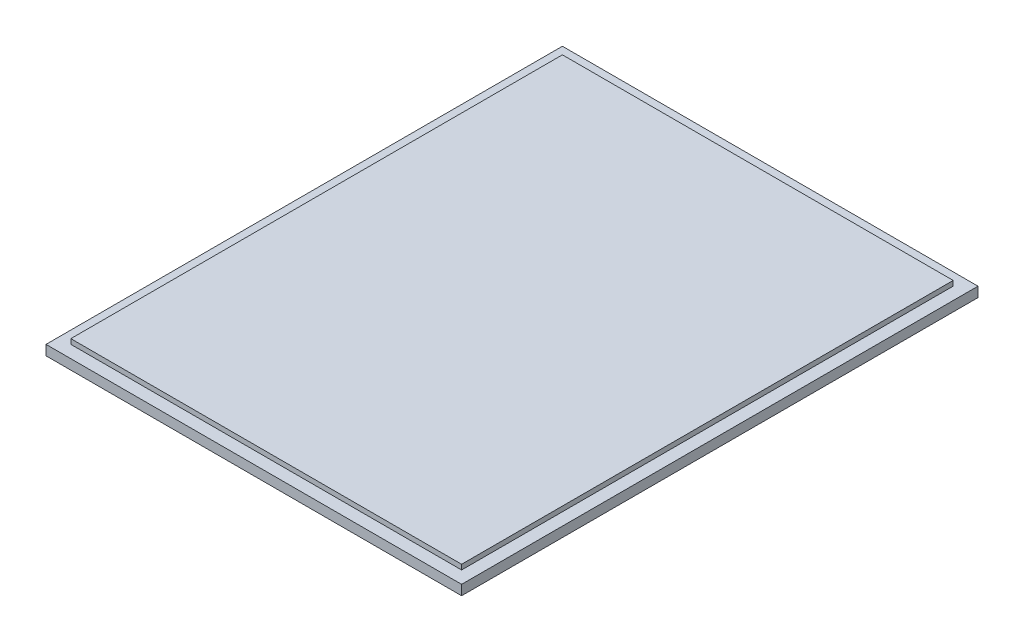
from build123d import *

# Parameters (mm, degrees)
SKETCH1_W           = 78.7
SKETCH1_H           = 99
BOSS_EXTRUDE2_DEPTH = 3
SKETCH1_5_W         = 83.7
SKETCH1_5_H         = 104
SKETCH1_5_W_2       = 78.7
SKETCH1_5_H_2       = 99
BOSS_EXTRUDE3_DEPTH = 2


with BuildPart() as part:
    # Sketch1 → Boss-Extrude2 (new body)
    with BuildSketch(Plane(origin=(0, 0, 0), x_dir=(1, 0, 0), z_dir=(0, 1, 0))):
        with Locations((12.02051789, -4.018674821)):
            Rectangle(SKETCH1_W, SKETCH1_H)
    extrude(amount=BOSS_EXTRUDE2_DEPTH)

    # Sketch1<5> → Boss-Extrude3 (add)
    with BuildSketch(Plane(origin=(0, 0, 0), x_dir=(1, 0, 0), z_dir=(0, 1, 0))):
        with Locations((12.02051789, -4.018674821)):
            Rectangle(SKETCH1_5_W, SKETCH1_5_H)
        with Locations((12.02051789, -4.018674821)):
            Rectangle(SKETCH1_5_W_2, SKETCH1_5_H_2, mode=Mode.SUBTRACT)
    extrude(amount=BOSS_EXTRUDE3_DEPTH)


solid = part.part
